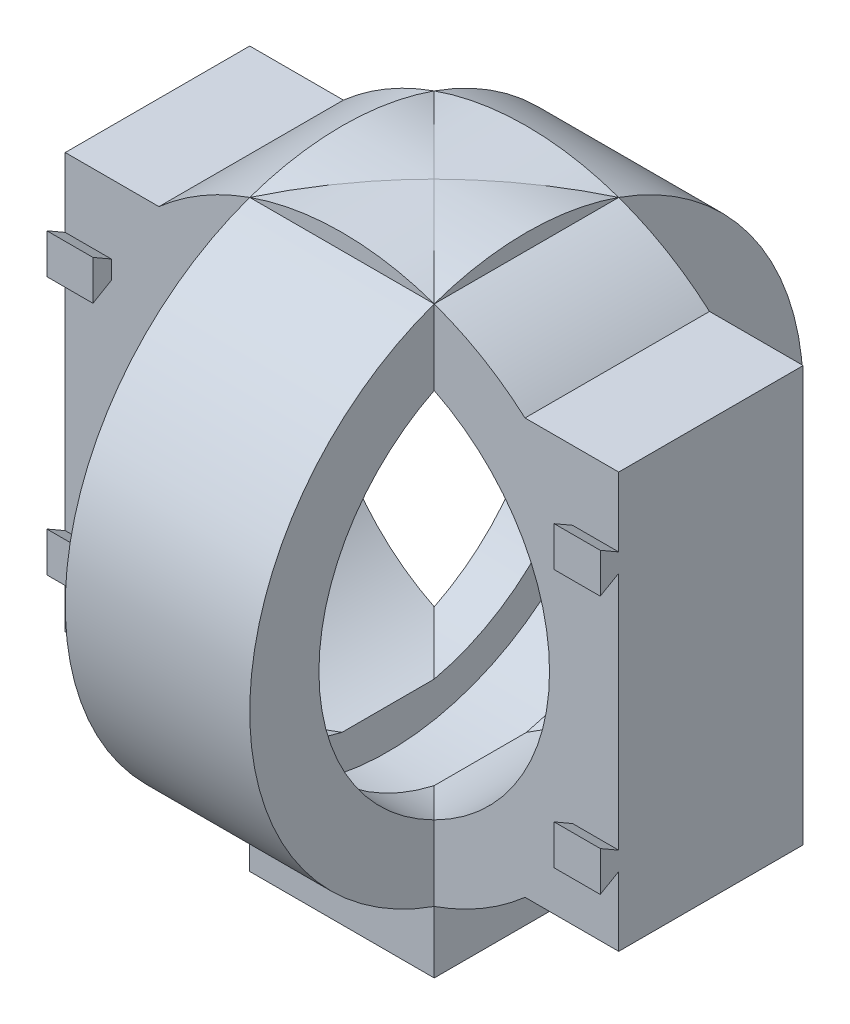
from build123d import *

# Parameters (mm, degrees)
ESQUISSE1_R                  = 60
ESQUISSE1_R_2                = 45
BOSS_EXTRU_1_DEPTH           = 40
BOSS_EXTRU_3_REACH           = 142
BOSS_EXTRU_3_END_RADIUS      = 60
ESQUISSE5_W                  = 40
ESQUISSE5_H                  = 90
BOSS_EXTRU_4_DEPTH           = 10
R_P_TITION_CIRCULAIRE1_COUNT = 2
R_P_TITION_CIRCULAIRE1_ANGLE = 90
ESQUISSE11_W                 = 20
ESQUISSE11_H                 = 15
BOSS_EXTRU_7_REACH           = 166.012
ESQUISSE17_W                 = 40
ESQUISSE17_H                 = 40


with BuildPart() as part:
    # Esquisse1 → Boss.-Extru.1 (new body)
    with BuildSketch(Plane.XY):
        Circle(ESQUISSE1_R)
        Circle(ESQUISSE1_R_2, mode=Mode.SUBTRACT)
    boss_extru_1 = extrude(amount=BOSS_EXTRU_1_DEPTH)

    # Boss.-Extru.3: up to this cylinder (the profile starts outside it)
    boss_extru_3_end = Plane(origin=(0, 0, 20), z_dir=(0, 0, -1)) * Cylinder(BOSS_EXTRU_3_END_RADIUS, 405, mode=Mode.PRIVATE)
    # Esquisse5 → Boss.-Extru.3 (add, up to the surface)
    with BuildSketch(Plane(origin=(60, 0, 0), x_dir=(0, 0, -1), z_dir=(1, 0, 0)), mode=Mode.PRIVATE) as boss_extru_3_sk1:
        with Locations((-20, 0)):
            Rectangle(ESQUISSE5_W, ESQUISSE5_H)
    boss_extru_3_tool1 = extrude(boss_extru_3_sk1.sketch, amount=-BOSS_EXTRU_3_REACH, mode=Mode.PRIVATE) - boss_extru_3_end
    boss_extru_3 = boss_extru_3_tool1.solids().sort_by_distance((60, 0, 20))[0] + boss_extru_3_tool1.solids().sort_by_distance((60, 0, 20))[1]
    add(boss_extru_3)

    # Symétrie2: Boss.-Extru.3 across plane
    add(boss_extru_3.mirror(Plane(origin=(0, 0, 0), x_dir=(0, 0, 1), z_dir=(1, 0, 0))))

    # Esquisse7 → Boss.-Extru.4 (add)
    with BuildSketch(Plane(origin=(60, 0, 0), x_dir=(0, 0, -1), z_dir=(1, 0, 0))):
        Polygon((-40, 30), (-40, 26), (-44, 23.690598923), (-44, 32.309401077), align=None)
        Polygon((-44, -32.309401077), (-40, -30), (-40, -26), (-44, -23.690598923), align=None)
    boss_extru_4 = extrude(amount=-BOSS_EXTRU_4_DEPTH)

    # Symétrie3: Boss.-Extru.4 across plane
    add(boss_extru_4.mirror(Plane(origin=(0, 0, 0), x_dir=(0, 0, 1), z_dir=(1, 0, 0))))

    # Répétition circulaire1: Boss.-Extru.1 ×2 about axis
    r_p_tition_circulaire1_axis = Axis((0, -67.301071144, 20), (0, 1, 0))
    for i in range(1, R_P_TITION_CIRCULAIRE1_COUNT):
        add(boss_extru_1.rotate(r_p_tition_circulaire1_axis, i * R_P_TITION_CIRCULAIRE1_ANGLE / (R_P_TITION_CIRCULAIRE1_COUNT - 1)))

    # Esquisse11 → Enlèvement de matière-Révolution3 (revolve, cut)
    with BuildSketch(Plane.XY.offset(20), mode=Mode.PRIVATE) as enl_vement_de_mati_re_r_volution3_sk:
        with Locations((0, -45)):
            Rectangle(ESQUISSE11_W, ESQUISSE11_H)
    revolve(enl_vement_de_mati_re_r_volution3_sk.sketch.rotate(Axis((-20, 0, 20), (1, 0, 0)), 270), axis=Axis((-20, 0, 20), (1, 0, 0)), mode=Mode.SUBTRACT)

    # Esquisse17 → Boss.-Extru.7 (add, up to next)
    with BuildSketch(Plane(origin=(0, -70, 0), x_dir=(1, 0, 0), z_dir=(0, 1, 0)), mode=Mode.PRIVATE) as boss_extru_7_sk1:
        with Locations((0, -20)):
            Rectangle(ESQUISSE17_W, ESQUISSE17_H)
    boss_extru_7_tool1 = extrude(boss_extru_7_sk1.sketch, amount=BOSS_EXTRU_7_REACH, mode=Mode.PRIVATE) - part.part
    add(boss_extru_7_tool1.solids().sort_by_distance((0, -70, 20))[0])


solid = part.part
